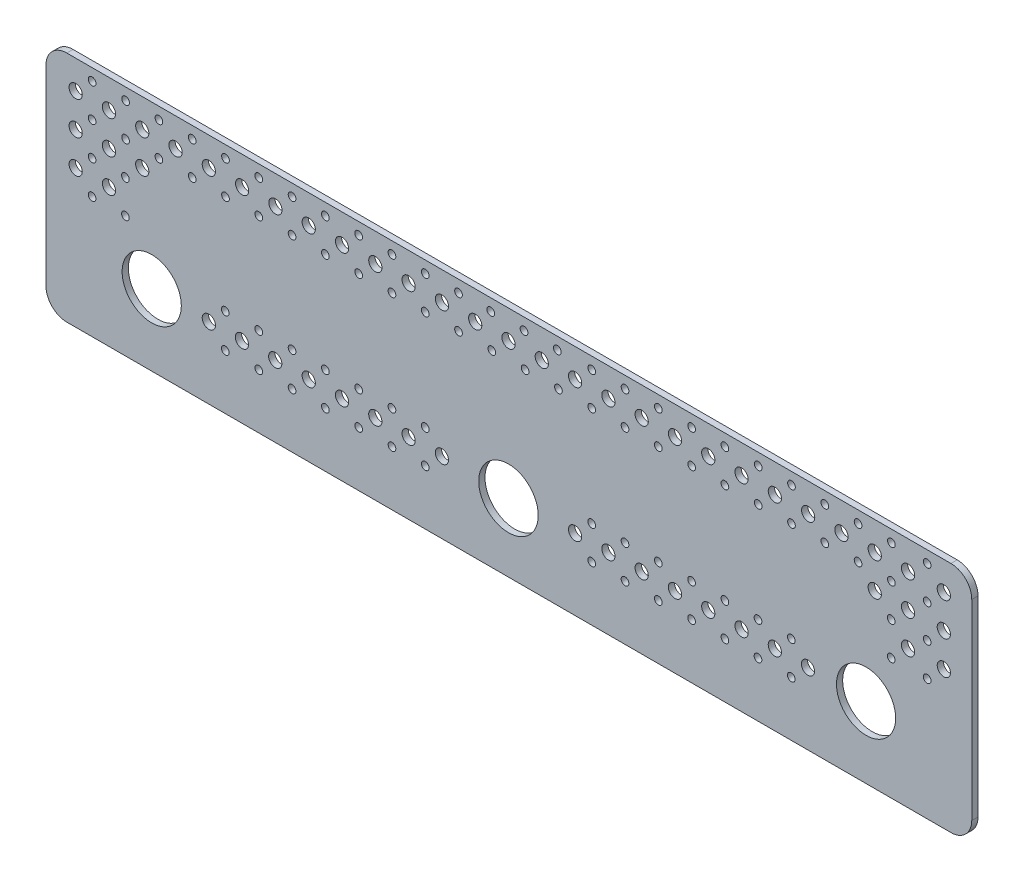
from build123d import *

# Parameters (mm, degrees)
SKETCH1_R           = 14.225
SKETCH1_R_2         = 14.3
SKETCH1_R_3         = 3.18
SKETCH1_R_4         = 1.85
BOSS_EXTRUDE1_DEPTH = 3


with BuildPart() as part:
    # Sketch1 → Boss-Extrude1 (new body)
    with BuildSketch(Plane.XY):
        with BuildLine():
            Line((-435.149770336, 91.084511017), (-10.273771909, 91.084511017))
            ThreePointArc((-10.273771909, 91.084511017), (-3.202704097, 88.155578829), (-0.273771909, 81.084511017))
            Line((-0.273771909, 81.084511017), (-0.273771909, -10.915488983))
            ThreePointArc((-0.273771909, -10.915488983), (-3.202704097, -17.986556794), (-10.273771909, -20.915488983))
            Line((-10.273771909, -20.915488983), (-435.149770336, -20.915488983))
            ThreePointArc((-435.149770336, -20.915488983), (-442.220838148, -17.986556794), (-445.149770336, -10.915488983))
            Line((-445.149770336, -10.915488983), (-445.149770336, 81.084511017))
            ThreePointArc((-445.149770336, 81.084511017), (-442.220838148, 88.155578829), (-435.149770336, 91.084511017))
        make_face()
        with Locations((-394.349770336, 13.384511017)):
            Circle(SKETCH1_R, mode=Mode.SUBTRACT)
        with Locations((-51.073771909, 13.384511017)):
            Circle(SKETCH1_R, mode=Mode.SUBTRACT)
        with Locations((-222.899770336, 11.884511017)):
            Circle(SKETCH1_R_2, mode=Mode.SUBTRACT)
        with Locations((-30.899770336, 61.384511017)):
            Circle(SKETCH1_R_3, mode=Mode.SUBTRACT)
        with Locations((-414.899770336, 61.384511017)):
            Circle(SKETCH1_R_3, mode=Mode.SUBTRACT)
        with Locations((-286.899770336, 13.384511017)):
            Circle(SKETCH1_R_3, mode=Mode.SUBTRACT)
        with Locations((-302.899770336, 13.384511017)):
            Circle(SKETCH1_R_3, mode=Mode.SUBTRACT)
        with Locations((-318.899770336, 13.384511017)):
            Circle(SKETCH1_R_3, mode=Mode.SUBTRACT)
        with Locations((-270.899770336, 13.384511017)):
            Circle(SKETCH1_R_3, mode=Mode.SUBTRACT)
        with Locations((-254.899770336, 13.384511017)):
            Circle(SKETCH1_R_3, mode=Mode.SUBTRACT)
        with Locations((-310.899770336, 5.384511017)):
            Circle(SKETCH1_R_4, mode=Mode.SUBTRACT)
        with Locations((-294.899770336, 5.384511017)):
            Circle(SKETCH1_R_4, mode=Mode.SUBTRACT)
        with Locations((-278.899770336, 5.384511017)):
            Circle(SKETCH1_R_4, mode=Mode.SUBTRACT)
        with Locations((-262.899770336, 5.384511017)):
            Circle(SKETCH1_R_4, mode=Mode.SUBTRACT)
        with Locations((-310.899770336, 21.384511017)):
            Circle(SKETCH1_R_4, mode=Mode.SUBTRACT)
        with Locations((-294.899770336, 21.384511017)):
            Circle(SKETCH1_R_4, mode=Mode.SUBTRACT)
        with Locations((-278.899770336, 21.384511017)):
            Circle(SKETCH1_R_4, mode=Mode.SUBTRACT)
        with Locations((-262.899770336, 21.384511017)):
            Circle(SKETCH1_R_4, mode=Mode.SUBTRACT)
        with Locations((-158.899770336, 13.384511017)):
            Circle(SKETCH1_R_3, mode=Mode.SUBTRACT)
        with Locations((-174.899770336, 13.384511017)):
            Circle(SKETCH1_R_3, mode=Mode.SUBTRACT)
        with Locations((-190.899770336, 13.384511017)):
            Circle(SKETCH1_R_3, mode=Mode.SUBTRACT)
        with Locations((-142.899770336, 13.384511017)):
            Circle(SKETCH1_R_3, mode=Mode.SUBTRACT)
        with Locations((-126.899770336, 13.384511017)):
            Circle(SKETCH1_R_3, mode=Mode.SUBTRACT)
        with Locations((-182.899770336, 5.384511017)):
            Circle(SKETCH1_R_4, mode=Mode.SUBTRACT)
        with Locations((-166.899770336, 5.384511017)):
            Circle(SKETCH1_R_4, mode=Mode.SUBTRACT)
        with Locations((-150.899770336, 5.384511017)):
            Circle(SKETCH1_R_4, mode=Mode.SUBTRACT)
        with Locations((-134.899770336, 5.384511017)):
            Circle(SKETCH1_R_4, mode=Mode.SUBTRACT)
        with Locations((-182.899770336, 21.384511017)):
            Circle(SKETCH1_R_4, mode=Mode.SUBTRACT)
        with Locations((-166.899770336, 21.384511017)):
            Circle(SKETCH1_R_4, mode=Mode.SUBTRACT)
        with Locations((-150.899770336, 21.384511017)):
            Circle(SKETCH1_R_4, mode=Mode.SUBTRACT)
        with Locations((-134.899770336, 21.384511017)):
            Circle(SKETCH1_R_4, mode=Mode.SUBTRACT)
        with Locations((-318.899770336, 77.384511017)):
            Circle(SKETCH1_R_3, mode=Mode.SUBTRACT)
        with Locations((-334.899770336, 77.384511017)):
            Circle(SKETCH1_R_3, mode=Mode.SUBTRACT)
        with Locations((-302.899770336, 77.384511017)):
            Circle(SKETCH1_R_3, mode=Mode.SUBTRACT)
        with Locations((-286.899770336, 77.384511017)):
            Circle(SKETCH1_R_3, mode=Mode.SUBTRACT)
        with Locations((-310.899770336, 69.384511017)):
            Circle(SKETCH1_R_4, mode=Mode.SUBTRACT)
        with Locations((-294.899770336, 69.384511017)):
            Circle(SKETCH1_R_4, mode=Mode.SUBTRACT)
        with Locations((-278.899770336, 69.384511017)):
            Circle(SKETCH1_R_4, mode=Mode.SUBTRACT)
        with Locations((-262.899770336, 69.384511017)):
            Circle(SKETCH1_R_4, mode=Mode.SUBTRACT)
        with Locations((-310.899770336, 85.384511017)):
            Circle(SKETCH1_R_4, mode=Mode.SUBTRACT)
        with Locations((-294.899770336, 85.384511017)):
            Circle(SKETCH1_R_4, mode=Mode.SUBTRACT)
        with Locations((-278.899770336, 85.384511017)):
            Circle(SKETCH1_R_4, mode=Mode.SUBTRACT)
        with Locations((-262.899770336, 85.384511017)):
            Circle(SKETCH1_R_4, mode=Mode.SUBTRACT)
        with Locations((-270.899770336, 77.384511017)):
            Circle(SKETCH1_R_3, mode=Mode.SUBTRACT)
        with Locations((-142.899770336, 77.384511017)):
            Circle(SKETCH1_R_3, mode=Mode.SUBTRACT)
        with Locations((-158.899770336, 77.384511017)):
            Circle(SKETCH1_R_3, mode=Mode.SUBTRACT)
        with Locations((-174.899770336, 77.384511017)):
            Circle(SKETCH1_R_3, mode=Mode.SUBTRACT)
        with Locations((-126.899770336, 77.384511017)):
            Circle(SKETCH1_R_3, mode=Mode.SUBTRACT)
        with Locations((-110.899770336, 77.384511017)):
            Circle(SKETCH1_R_3, mode=Mode.SUBTRACT)
        with Locations((-182.899770336, 69.384511017)):
            Circle(SKETCH1_R_4, mode=Mode.SUBTRACT)
        with Locations((-166.899770336, 69.384511017)):
            Circle(SKETCH1_R_4, mode=Mode.SUBTRACT)
        with Locations((-150.899770336, 69.384511017)):
            Circle(SKETCH1_R_4, mode=Mode.SUBTRACT)
        with Locations((-134.899770336, 69.384511017)):
            Circle(SKETCH1_R_4, mode=Mode.SUBTRACT)
        with Locations((-182.899770336, 85.384511017)):
            Circle(SKETCH1_R_4, mode=Mode.SUBTRACT)
        with Locations((-166.899770336, 85.384511017)):
            Circle(SKETCH1_R_4, mode=Mode.SUBTRACT)
        with Locations((-150.899770336, 85.384511017)):
            Circle(SKETCH1_R_4, mode=Mode.SUBTRACT)
        with Locations((-134.899770336, 85.384511017)):
            Circle(SKETCH1_R_4, mode=Mode.SUBTRACT)
        with Locations((-222.899770336, 77.384511017)):
            Circle(SKETCH1_R_3, mode=Mode.SUBTRACT)
        with Locations((-238.899770336, 77.384511017)):
            Circle(SKETCH1_R_3, mode=Mode.SUBTRACT)
        with Locations((-254.899770336, 77.384511017)):
            Circle(SKETCH1_R_3, mode=Mode.SUBTRACT)
        with Locations((-206.899770336, 77.384511017)):
            Circle(SKETCH1_R_3, mode=Mode.SUBTRACT)
        with Locations((-190.899770336, 77.384511017)):
            Circle(SKETCH1_R_3, mode=Mode.SUBTRACT)
        with Locations((-246.899770336, 69.384511017)):
            Circle(SKETCH1_R_4, mode=Mode.SUBTRACT)
        with Locations((-230.899770336, 69.384511017)):
            Circle(SKETCH1_R_4, mode=Mode.SUBTRACT)
        with Locations((-214.899770336, 69.384511017)):
            Circle(SKETCH1_R_4, mode=Mode.SUBTRACT)
        with Locations((-198.899770336, 69.384511017)):
            Circle(SKETCH1_R_4, mode=Mode.SUBTRACT)
        with Locations((-246.899770336, 85.384511017)):
            Circle(SKETCH1_R_4, mode=Mode.SUBTRACT)
        with Locations((-231.427182614, 85.384511017)):
            Circle(SKETCH1_R_4, mode=Mode.SUBTRACT)
        with Locations((-215.427182614, 85.384511017)):
            Circle(SKETCH1_R_4, mode=Mode.SUBTRACT)
        with Locations((-199.427182614, 85.384511017)):
            Circle(SKETCH1_R_4, mode=Mode.SUBTRACT)
        with Locations((-398.899770336, 77.384511017)):
            Circle(SKETCH1_R_3, mode=Mode.SUBTRACT)
        with Locations((-414.899770336, 77.384511017)):
            Circle(SKETCH1_R_3, mode=Mode.SUBTRACT)
        with Locations((-382.899770336, 77.384511017)):
            Circle(SKETCH1_R_3, mode=Mode.SUBTRACT)
        with Locations((-366.899770336, 77.384511017)):
            Circle(SKETCH1_R_3, mode=Mode.SUBTRACT)
        with Locations((-390.899770336, 69.384511017)):
            Circle(SKETCH1_R_4, mode=Mode.SUBTRACT)
        with Locations((-374.899770336, 69.384511017)):
            Circle(SKETCH1_R_4, mode=Mode.SUBTRACT)
        with Locations((-358.899770336, 69.384511017)):
            Circle(SKETCH1_R_4, mode=Mode.SUBTRACT)
        with Locations((-342.899770336, 69.384511017)):
            Circle(SKETCH1_R_4, mode=Mode.SUBTRACT)
        with Locations((-390.899770336, 85.384511017)):
            Circle(SKETCH1_R_4, mode=Mode.SUBTRACT)
        with Locations((-374.899770336, 85.384511017)):
            Circle(SKETCH1_R_4, mode=Mode.SUBTRACT)
        with Locations((-358.899770336, 85.384511017)):
            Circle(SKETCH1_R_4, mode=Mode.SUBTRACT)
        with Locations((-342.899770336, 85.384511017)):
            Circle(SKETCH1_R_4, mode=Mode.SUBTRACT)
        with Locations((-350.899770336, 77.384511017)):
            Circle(SKETCH1_R_3, mode=Mode.SUBTRACT)
        with Locations((-78.899770336, 77.384511017)):
            Circle(SKETCH1_R_3, mode=Mode.SUBTRACT)
        with Locations((-94.899770336, 77.384511017)):
            Circle(SKETCH1_R_3, mode=Mode.SUBTRACT)
        with Locations((-62.899770336, 77.384511017)):
            Circle(SKETCH1_R_3, mode=Mode.SUBTRACT)
        with Locations((-46.899770336, 77.384511017)):
            Circle(SKETCH1_R_3, mode=Mode.SUBTRACT)
        with Locations((-86.899770336, 69.384511017)):
            Circle(SKETCH1_R_4, mode=Mode.SUBTRACT)
        with Locations((-70.899770336, 69.384511017)):
            Circle(SKETCH1_R_4, mode=Mode.SUBTRACT)
        with Locations((-54.899770336, 69.384511017)):
            Circle(SKETCH1_R_4, mode=Mode.SUBTRACT)
        with Locations((-38.899770336, 69.384511017)):
            Circle(SKETCH1_R_4, mode=Mode.SUBTRACT)
        with Locations((-86.899770336, 85.384511017)):
            Circle(SKETCH1_R_4, mode=Mode.SUBTRACT)
        with Locations((-70.899770336, 85.384511017)):
            Circle(SKETCH1_R_4, mode=Mode.SUBTRACT)
        with Locations((-54.899770336, 85.384511017)):
            Circle(SKETCH1_R_4, mode=Mode.SUBTRACT)
        with Locations((-38.899770336, 85.384511017)):
            Circle(SKETCH1_R_4, mode=Mode.SUBTRACT)
        with Locations((-30.899770336, 77.384511017)):
            Circle(SKETCH1_R_3, mode=Mode.SUBTRACT)
        with Locations((-430.899770336, 77.384511017)):
            Circle(SKETCH1_R_3, mode=Mode.SUBTRACT)
        with Locations((-430.899770336, 61.384511017)):
            Circle(SKETCH1_R_3, mode=Mode.SUBTRACT)
        with Locations((-422.995687615, 69.384511017)):
            Circle(SKETCH1_R_4, mode=Mode.SUBTRACT)
        with Locations((-406.899770336, 69.384511017)):
            Circle(SKETCH1_R_4, mode=Mode.SUBTRACT)
        with Locations((-422.995687615, 85.384511017)):
            Circle(SKETCH1_R_4, mode=Mode.SUBTRACT)
        with Locations((-406.899770336, 85.384511017)):
            Circle(SKETCH1_R_4, mode=Mode.SUBTRACT)
        with Locations((-13.700814934, 61.384511017)):
            Circle(SKETCH1_R_3, mode=Mode.SUBTRACT)
        with Locations((-21.700814934, 69.384511017)):
            Circle(SKETCH1_R_4, mode=Mode.SUBTRACT)
        with Locations((-21.700814934, 85.384511017)):
            Circle(SKETCH1_R_4, mode=Mode.SUBTRACT)
        with Locations((-13.700814934, 77.384511017)):
            Circle(SKETCH1_R_3, mode=Mode.SUBTRACT)
        with Locations((-118.899770336, 69.384511017)):
            Circle(SKETCH1_R_4, mode=Mode.SUBTRACT)
        with Locations((-102.899770336, 69.384511017)):
            Circle(SKETCH1_R_4, mode=Mode.SUBTRACT)
        with Locations((-118.899770336, 85.384511017)):
            Circle(SKETCH1_R_4, mode=Mode.SUBTRACT)
        with Locations((-102.899770336, 85.384511017)):
            Circle(SKETCH1_R_4, mode=Mode.SUBTRACT)
        with Locations((-326.899770336, 69.384511017)):
            Circle(SKETCH1_R_4, mode=Mode.SUBTRACT)
        with Locations((-326.899770336, 85.384511017)):
            Circle(SKETCH1_R_4, mode=Mode.SUBTRACT)
        with Locations((-334.995687615, 13.384511017)):
            Circle(SKETCH1_R_3, mode=Mode.SUBTRACT)
        with Locations((-350.995687615, 13.384511017)):
            Circle(SKETCH1_R_3, mode=Mode.SUBTRACT)
        with Locations((-366.899770336, 13.384511017)):
            Circle(SKETCH1_R_3, mode=Mode.SUBTRACT)
        with Locations((-358.995687615, 5.384511017)):
            Circle(SKETCH1_R_4, mode=Mode.SUBTRACT)
        with Locations((-342.899770336, 5.384511017)):
            Circle(SKETCH1_R_4, mode=Mode.SUBTRACT)
        with Locations((-326.899770336, 5.384511017)):
            Circle(SKETCH1_R_4, mode=Mode.SUBTRACT)
        with Locations((-358.995687615, 21.719099167)):
            Circle(SKETCH1_R_4, mode=Mode.SUBTRACT)
        with Locations((-342.899770336, 21.719099167)):
            Circle(SKETCH1_R_4, mode=Mode.SUBTRACT)
        with Locations((-326.899770336, 21.719099167)):
            Circle(SKETCH1_R_4, mode=Mode.SUBTRACT)
        with Locations((-110.899770336, 13.384511017)):
            Circle(SKETCH1_R_3, mode=Mode.SUBTRACT)
        with Locations((-94.899770336, 13.384511017)):
            Circle(SKETCH1_R_3, mode=Mode.SUBTRACT)
        with Locations((-78.995687615, 13.384511017)):
            Circle(SKETCH1_R_3, mode=Mode.SUBTRACT)
        with Locations((-118.899770336, 5.384511017)):
            Circle(SKETCH1_R_4, mode=Mode.SUBTRACT)
        with Locations((-102.995687615, 5.384511017)):
            Circle(SKETCH1_R_4, mode=Mode.SUBTRACT)
        with Locations((-86.995687615, 5.384511017)):
            Circle(SKETCH1_R_4, mode=Mode.SUBTRACT)
        with Locations((-118.899770336, 21.384511017)):
            Circle(SKETCH1_R_4, mode=Mode.SUBTRACT)
        with Locations((-102.995687615, 21.384511017)):
            Circle(SKETCH1_R_4, mode=Mode.SUBTRACT)
        with Locations((-86.995687615, 21.384511017)):
            Circle(SKETCH1_R_4, mode=Mode.SUBTRACT)
        with Locations((-422.995687615, 37.384511017)):
            Circle(SKETCH1_R_4, mode=Mode.SUBTRACT)
        with Locations((-406.995687615, 37.384511017)):
            Circle(SKETCH1_R_4, mode=Mode.SUBTRACT)
        with Locations((-422.995687615, 53.384511017)):
            Circle(SKETCH1_R_4, mode=Mode.SUBTRACT)
        with Locations((-406.995687615, 53.384511017)):
            Circle(SKETCH1_R_4, mode=Mode.SUBTRACT)
        with Locations((-38.995687615, 37.384511017)):
            Circle(SKETCH1_R_4, mode=Mode.SUBTRACT)
        with Locations((-38.995687615, 53.384511017)):
            Circle(SKETCH1_R_4, mode=Mode.SUBTRACT)
        with Locations((-21.700814934, 37.384511017)):
            Circle(SKETCH1_R_4, mode=Mode.SUBTRACT)
        with Locations((-21.700814934, 53.384511017)):
            Circle(SKETCH1_R_4, mode=Mode.SUBTRACT)
        with Locations((-398.899770336, 61.384511017)):
            Circle(SKETCH1_R_3, mode=Mode.SUBTRACT)
        with Locations((-414.899770336, 45.384511017)):
            Circle(SKETCH1_R_3, mode=Mode.SUBTRACT)
        with Locations((-430.899770336, 45.384511017)):
            Circle(SKETCH1_R_3, mode=Mode.SUBTRACT)
        with Locations((-46.899770336, 61.384511017)):
            Circle(SKETCH1_R_3, mode=Mode.SUBTRACT)
        with Locations((-30.899770336, 45.384511017)):
            Circle(SKETCH1_R_3, mode=Mode.SUBTRACT)
        with Locations((-13.700814934, 45.384511017)):
            Circle(SKETCH1_R_3, mode=Mode.SUBTRACT)
    extrude(amount=BOSS_EXTRUDE1_DEPTH)


solid = part.part
